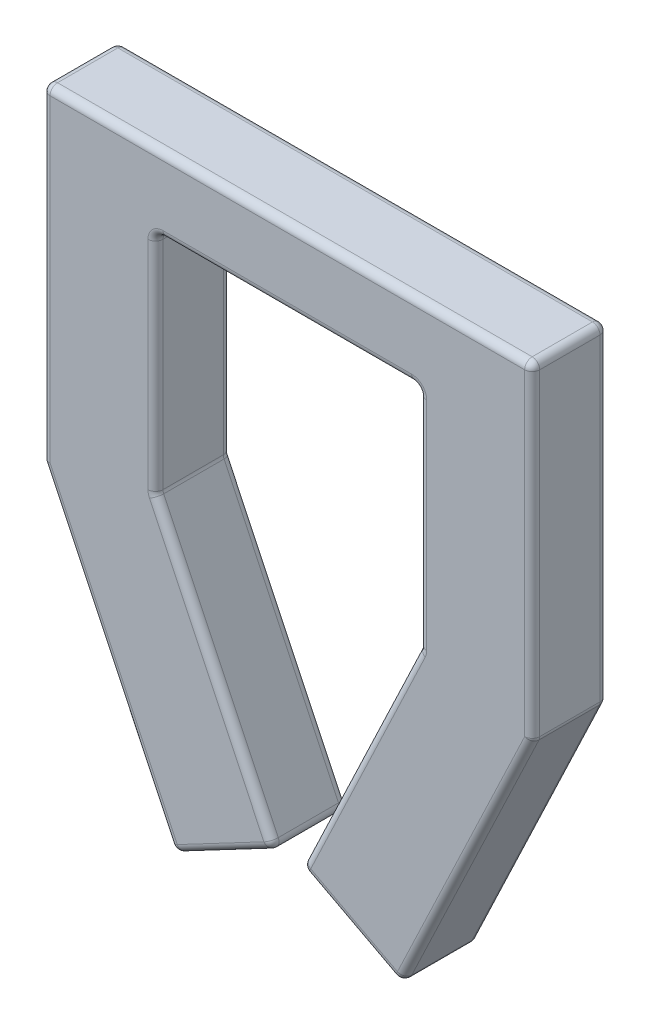
from build123d import *

# Parameters (mm, degrees)
BOSS_EXTRUDE1_DEPTH = 10
FILLET1_R           = 1


with BuildPart() as part:
    # Sketch1 → Boss-Extrude1 (new body)
    with BuildSketch(Plane.XY):
        Polygon((0, 40), (0, 36.611522599), (17.430453908, 0), (30.708058647, 7.006255421), (15, 40), (15, 70), (50, 70), (50, 40), (34.291941353, 7.006255421), (47.569546092, 0), (65, 36.611522599), (65, 80), (0, 80), align=None)
    extrude(amount=BOSS_EXTRUDE1_DEPTH)

    # Fillet1
    fillet1_edges = [part.edges().sort_by_distance(p)[0] for p in [
        (15, 55, 10),
        (24.069256278, 3.50312771, 0),
        (8.715226954, 18.3057613, 0),
        (0, 58.3057613, 0),
        (32.5, 80, 0),
        (65, 58.3057613, 0),
        (32.5, 70, 10),
        (56.284773046, 18.3057613, 0),
        (40.930743722, 3.50312771, 0),
        (42.145970676, 23.50312771, 0),
        (50, 55, 0),
        (32.5, 70, 0),
        (15, 55, 0),
        (22.854029324, 23.50312771, 0),
        (50, 55, 10),
        (30.708058647, 7.006255421, 5),
        (17.430453908, 0, 5),
        (0, 80, 5),
        (65, 80, 5),
        (65, 36.611522599, 5),
        (47.569546092, 0, 5),
        (34.291941353, 7.006255421, 5),
        (50, 40, 5),
        (50, 70, 5),
        (15, 70, 5),
        (15, 40, 5),
        (42.145970676, 23.50312771, 10),
        (40.930743722, 3.50312771, 10),
        (56.284773046, 18.3057613, 10),
        (65, 58.3057613, 10),
        (32.5, 80, 10),
        (0, 58.3057613, 10),
        (8.715226954, 18.3057613, 10),
        (22.854029324, 23.50312771, 10),
        (24.069256278, 3.50312771, 10),
    ]]
    fillet(fillet1_edges, radius=FILLET1_R)


solid = part.part
